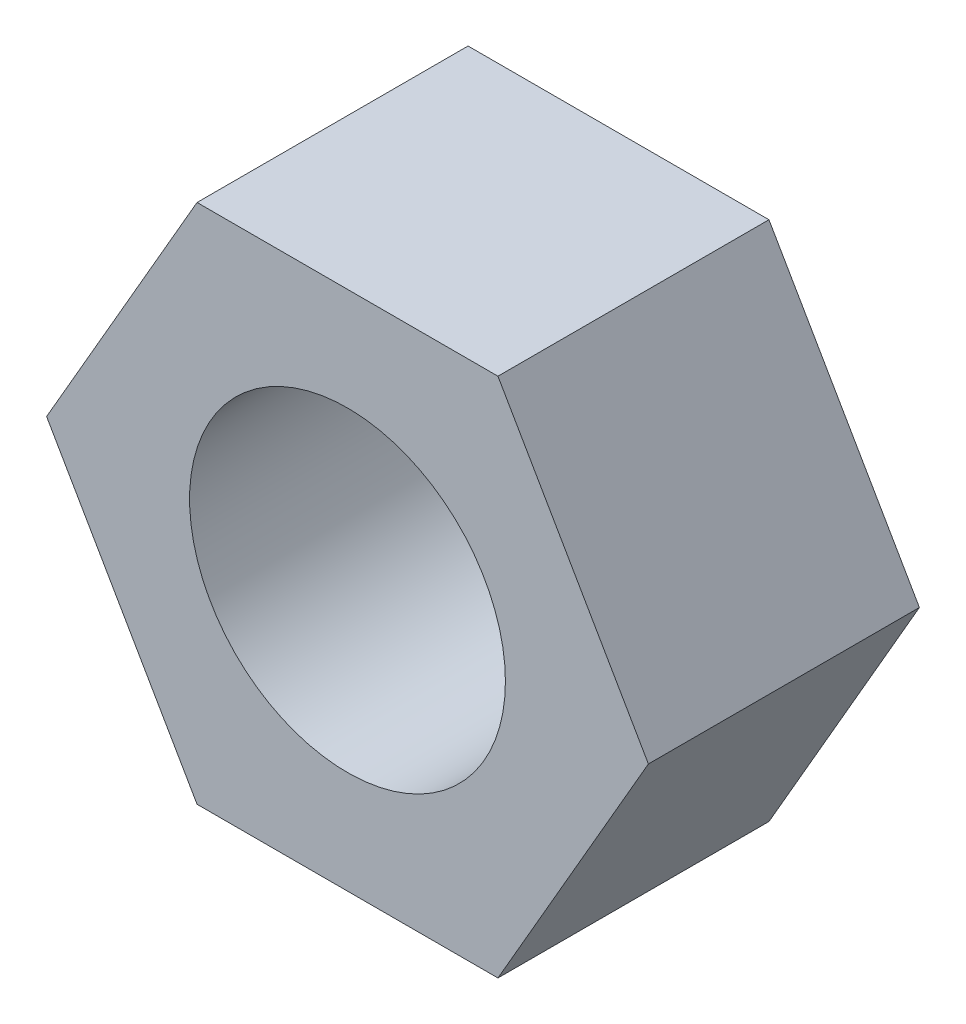
from build123d import *

# Parameters (mm, degrees)
S01_ISO_4032_M6_X_1_RH_HEX_NUT_AF10_X_R        = 3.03
F_01_ISO_4032_M6_X_1_RH_HEX_NUT_AF10_X_5_DEPTH = 5.2


with BuildPart() as part:
    # S01 - ISO 4032 M6 x 1 RH hex nut AF10 x 5.2 → 01 - ISO 4032 M6 x 1 RH hex nut AF10 x 5.2 (new body)
    with BuildSketch(Plane.XY):
        Polygon((5.773502692, 0), (2.886751346, 5), (-2.886751346, 5), (-5.773502692, 0), (-2.886751346, -5), (2.886751346, -5), align=None)
        Circle(S01_ISO_4032_M6_X_1_RH_HEX_NUT_AF10_X_R, mode=Mode.SUBTRACT)
    extrude(amount=F_01_ISO_4032_M6_X_1_RH_HEX_NUT_AF10_X_5_DEPTH)


solid = part.part
